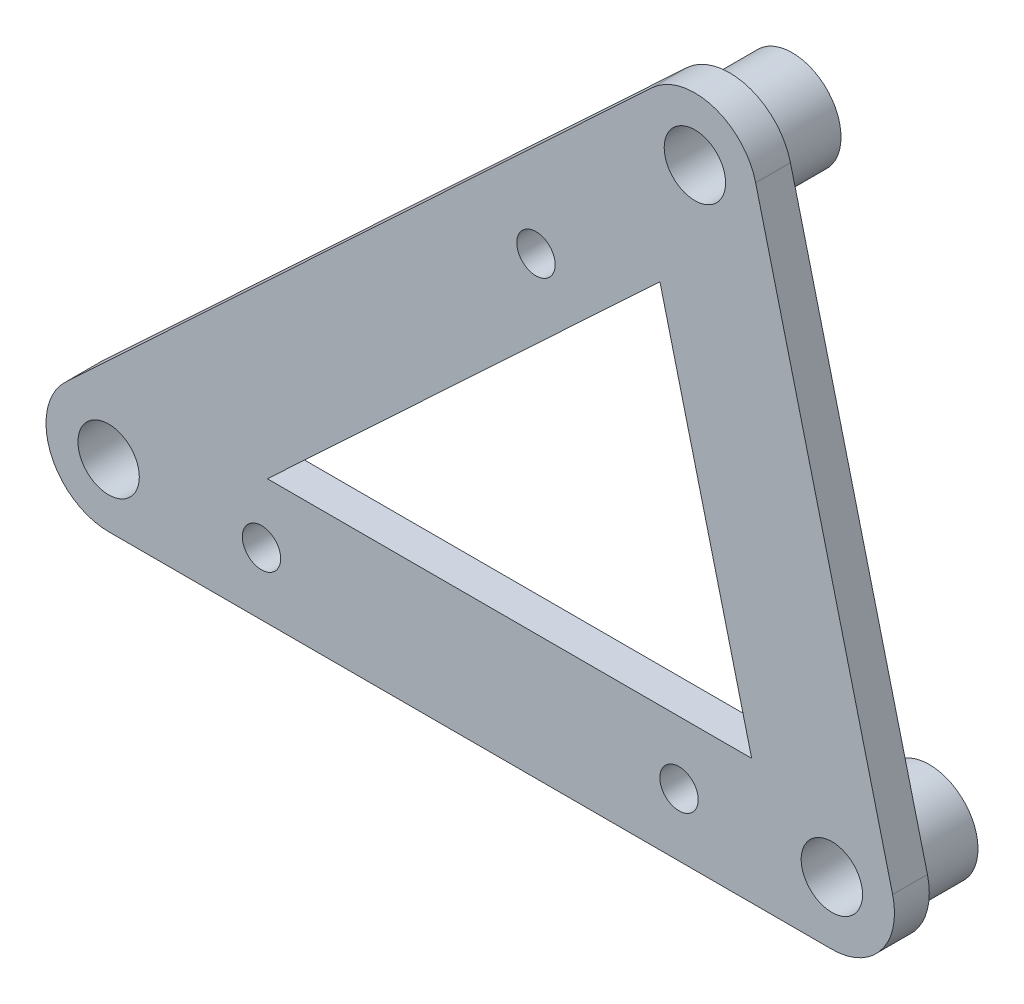
from build123d import *

# Parameters (mm, degrees)
SKETCH1_R             = 4.445
SKETCH1_R_2           = 2.8
BOSS_EXTRUDE1_DEPTH   = 5.715
BOSS_EXTRUDE1_2_DEPTH = 5.715
BOSS_EXTRUDE1_3_DEPTH = 5.715
SKETCH2_R             = 4.445
SKETCH2_R_2           = 2.8
BOSS_EXTRUDE5_DEPTH   = 3.175
SKETCH2_3_R           = 4.445
SKETCH2_3_R_2         = 2.8
BOSS_EXTRUDE6_DEPTH   = 3.175
CUT_EXTRUDE1_DEPTH    = 5.08
SKETCH4_R             = 1.75
CUT_EXTRUDE2_DEPTH    = 118.202447393


with BuildPart() as part:
    # Sketch1 → Boss-Extrude1 (new body)
    with BuildSketch(Plane.XY):
        with Locations((-91.5, -59.5)):
            Circle(SKETCH1_R)
        with Locations((-91.5, -59.5)):
            Circle(SKETCH1_R_2, mode=Mode.SUBTRACT)
    extrude(amount=BOSS_EXTRUDE1_DEPTH)



with BuildPart() as body_2:
    # Sketch1 → Boss-Extrude1 2 (new body)
    with BuildSketch(Plane.XY):
        with Locations((-25.5, -59.5)):
            Circle(SKETCH1_R)
        with Locations((-25.5, -59.5)):
            Circle(SKETCH1_R_2, mode=Mode.SUBTRACT)
    extrude(amount=BOSS_EXTRUDE1_2_DEPTH)


with BuildPart() as body_3:
    # Sketch1 → Boss-Extrude1 3 (new body)
    with BuildSketch(Plane.XY):
        with Locations((-38, -9.5)):
            Circle(SKETCH1_R)
        with Locations((-38, -9.5)):
            Circle(SKETCH1_R_2, mode=Mode.SUBTRACT)
    extrude(amount=BOSS_EXTRUDE1_3_DEPTH)


with BuildPart() as part_1:
    add(part.part)

    add(body_3.part)  # Boss-Extrude5 merges body 3
    # Sketch2 → Boss-Extrude5 (add)
    with BuildSketch(Plane.XY.offset(5.715)):
        with BuildLine():
            Line((-19.955635612, -58.113908903), (-32.455635612, -8.113908903))
            ThreePointArc((-32.455635612, -8.113908903), (-36.381608185, -4.018938704), (-41.902228623, -5.324615374))
            Line((-41.902228623, -5.324615374), (-95.402228623, -55.324615374))
            ThreePointArc((-95.402228623, -55.324615374), (-96.816180402, -61.597486813), (-91.5, -65.215))
            Line((-91.5, -65.215), (-25.5, -65.215))
            ThreePointArc((-25.5, -65.215), (-20.995405922, -63.017080777), (-19.955635612, -58.113908903))
        make_face()
        with Locations((-25.5, -59.5)):
            Circle(SKETCH2_R, mode=Mode.SUBTRACT)
        Polygon((-77.015059827, -53.785), (-41.189982364, -20.303619193), (-32.819637163, -53.785), align=None, mode=Mode.SUBTRACT)
        with Locations((-91.5, -59.5)):
            Circle(SKETCH2_R_2, mode=Mode.SUBTRACT)
        with Locations(Location((-38, -9.5, 0), (0, 0, 180))):
            Circle(SKETCH2_R_2, mode=Mode.SUBTRACT)
    extrude(amount=BOSS_EXTRUDE5_DEPTH)


    add(body_2.part)  # Boss-Extrude6 merges body 2
    # Sketch2<3> → Boss-Extrude6 (add)
    with BuildSketch(Plane.XY.offset(5.715)):
        with Locations((-25.5, -59.5)):
            Circle(SKETCH2_3_R)
        with Locations((-25.5, -59.5)):
            Circle(SKETCH2_3_R_2, mode=Mode.SUBTRACT)
    extrude(amount=BOSS_EXTRUDE6_DEPTH)

    # Sketch3 → Cut-Extrude1 (cut)
    with BuildSketch(Plane.XY.offset(8.89)):
        with BuildLine():
            ThreePointArc((-75.8, -59.5), (-77.55, -57.75), (-79.3, -59.5))
            Line((-79.3, -59.5), (-75.8, -59.5))
        make_face()
        with BuildLine():
            Line((-75.8, -59.5), (-79.3, -59.5))
            ThreePointArc((-79.3, -59.5), (-77.55, -61.25), (-75.8, -59.5))
        make_face()
        with BuildLine():
            ThreePointArc((-37.7, -59.5), (-39.45, -57.75), (-41.2, -59.5))
            Line((-41.2, -59.5), (-37.7, -59.5))
        make_face()
        with BuildLine():
            Line((-37.7, -59.5), (-41.2, -59.5))
            ThreePointArc((-41.2, -59.5), (-39.45, -61.25), (-37.7, -59.5))
        make_face()
    extrude(amount=-CUT_EXTRUDE1_DEPTH, mode=Mode.SUBTRACT)

    # Sketch4 → Cut-Extrude2 (cut, through all)
    with BuildSketch(Plane(origin=(0, 0, 5.715), x_dir=(-1, 0, 0), z_dir=(0, 0, -1))):
        with Locations((52.503366943, -23.745857138)):
            Circle(SKETCH4_R)
    extrude(amount=-CUT_EXTRUDE2_DEPTH, mode=Mode.SUBTRACT)


solid = part_1.part
